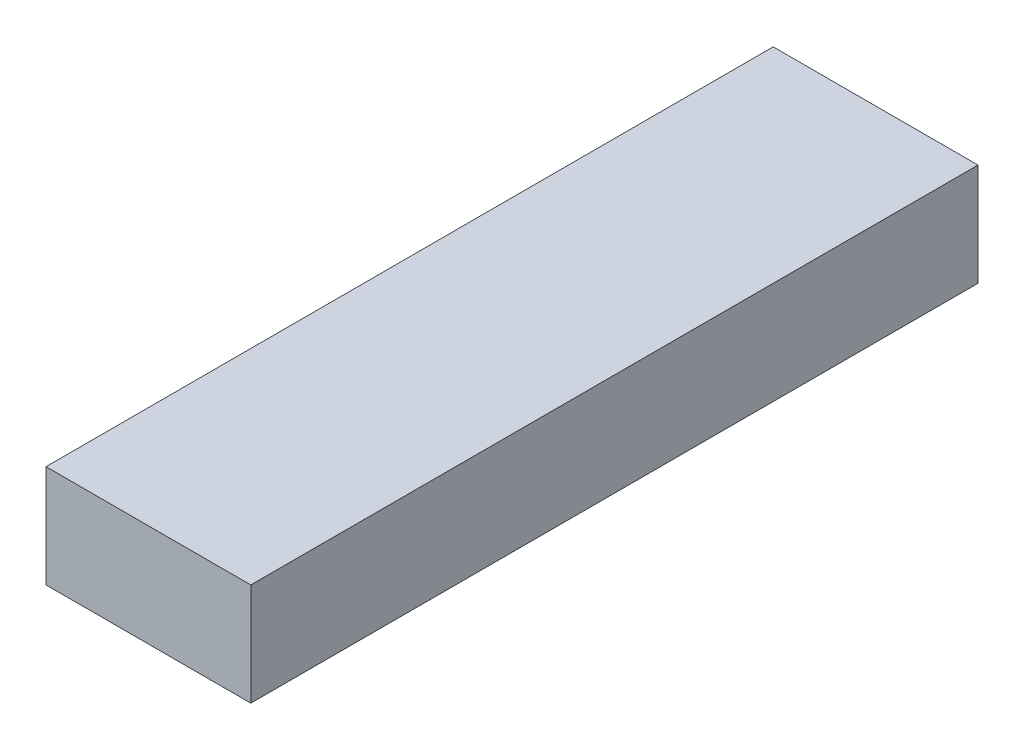
from build123d import *

# Parameters (mm, degrees)
SKETCH1_W           = 101.6
SKETCH1_H           = 50.8
BOSS_EXTRUDE1_DEPTH = 360.775677228


with BuildPart() as part:
    # Sketch1 → Boss-Extrude1 (new body)
    with BuildSketch(Plane.XY):
        Rectangle(SKETCH1_W, SKETCH1_H)
    extrude(amount=BOSS_EXTRUDE1_DEPTH)


solid = part.part
